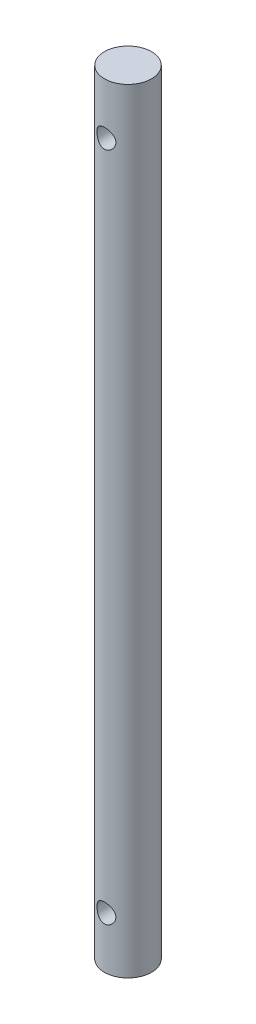
from build123d import *

# Parameters (mm, degrees)
SKETCH1_R           = 3.96
BOSS_EXTRUDE1_DEPTH = 65.09
SKETCH2_R           = 1.59
CUT_EXTRUDE1_DEPTH  = 66.330477574


with BuildPart() as part:
    # Sketch1 → Boss-Extrude1 (new, symmetric)
    with BuildSketch(Plane(origin=(0, 0, 0), x_dir=(1, 0, 0), z_dir=(0, 1, 0))):
        Circle(SKETCH1_R)
    extrude(amount=BOSS_EXTRUDE1_DEPTH, both=True)

    # Sketch2 → Cut-Extrude1 (cut, symmetric)
    with BuildSketch(Plane.XY):
        with Locations((0, 56.43)):
            Circle(SKETCH2_R)
    cut_extrude1 = extrude(amount=CUT_EXTRUDE1_DEPTH, both=True, mode=Mode.SUBTRACT)

    # Mirror1: Cut-Extrude1 across plane
    add(cut_extrude1.mirror(Plane.ZX), mode=Mode.SUBTRACT)


solid = part.part
